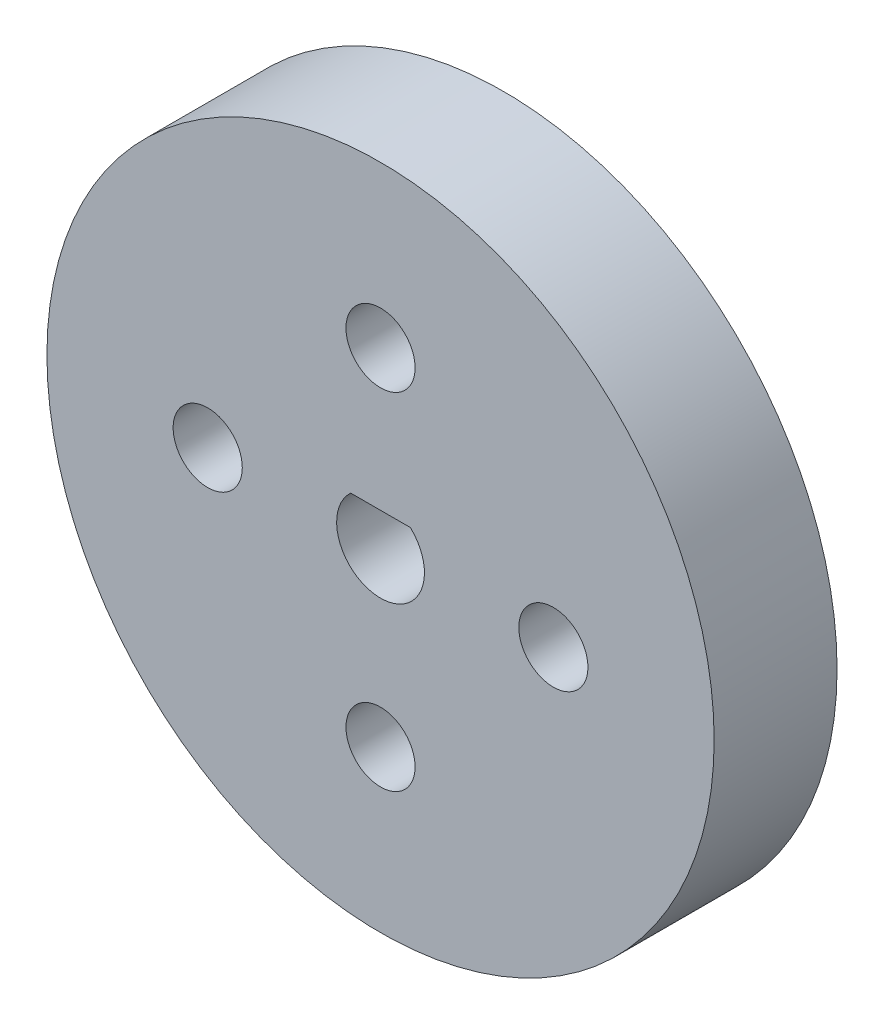
from build123d import *

# Parameters (mm, degrees)
SKETCH1_R           = 14.478
BOSS_EXTRUDE1_DEPTH = 5.334
SKETCH2_R           = 1.905
CUT_EXTRUDE2_DEPTH  = 5.334
BOSS_EXTRUDE3_DEPTH = 5.334
SKETCH4_R           = 1.5
CUT_EXTRUDE4_DEPTH  = 22.158367706


with BuildPart() as part:
    # Sketch1 → Boss-Extrude1 (new body)
    with BuildSketch(Plane.XY):
        Circle(SKETCH1_R)
    extrude(amount=BOSS_EXTRUDE1_DEPTH)

    # Sketch2 → Cut-Extrude2 (cut)
    with BuildSketch(Plane.XY.offset(5.334)):
        Circle(SKETCH2_R)
    extrude(amount=-CUT_EXTRUDE2_DEPTH, mode=Mode.SUBTRACT)

    # Sketch3 → Boss-Extrude3 (add)
    with BuildSketch(Plane.XY.offset(5.334)):
        with BuildLine():
            Line((-1.295150956, 1.397), (1.295150956, 1.397))
            ThreePointArc((1.295150956, 1.397), (0, 1.905), (-1.295150956, 1.397))
        make_face()
    extrude(amount=-BOSS_EXTRUDE3_DEPTH)

    # Sketch4 → Cut-Extrude4 (cut, through all)
    with BuildSketch(Plane(origin=(0, 0, 0), x_dir=(-1, 0, 0), z_dir=(0, 0, -1))):
        with Locations((0, -7.5)):
            Circle(SKETCH4_R)
        with Locations(Location((7.5, 0, 0), (0, 0, 180))):
            Circle(SKETCH4_R)
        with Locations(Location((-7.5, 0, 0), (0, 0, 180))):
            Circle(SKETCH4_R)
        with Locations((0, 7.5)):
            Circle(SKETCH4_R)
    extrude(amount=-CUT_EXTRUDE4_DEPTH, mode=Mode.SUBTRACT)


solid = part.part
